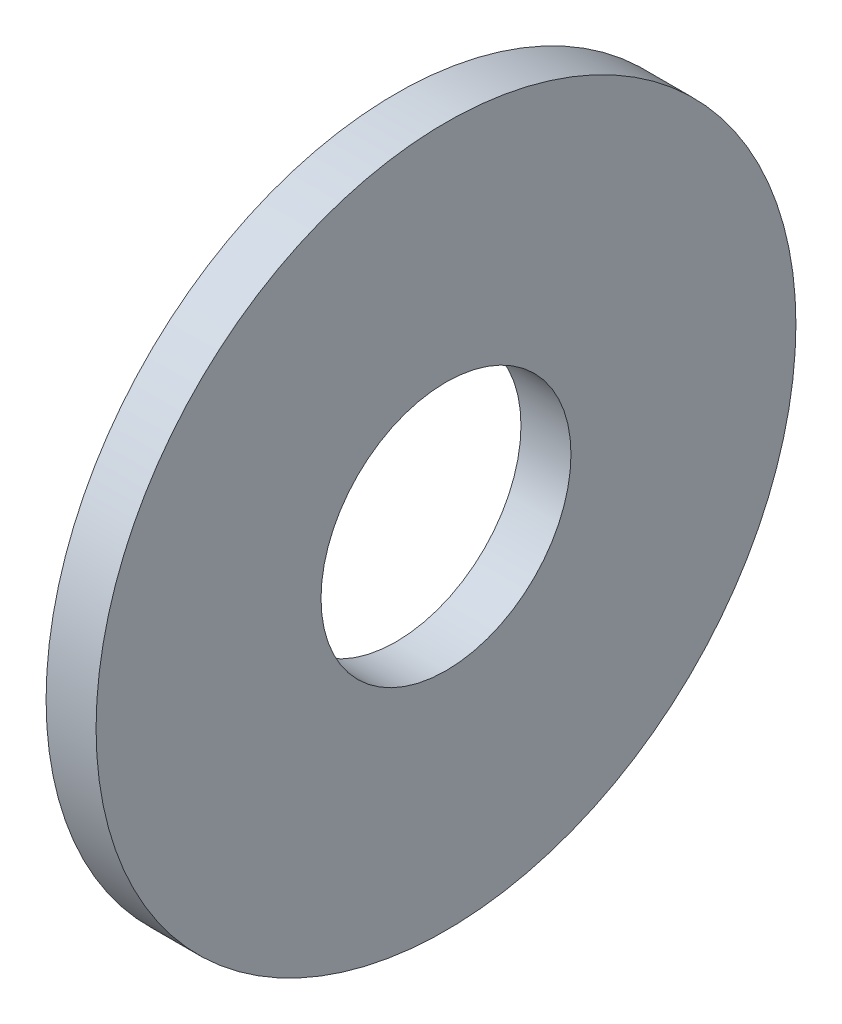
from build123d import *

# Parameters (mm, degrees)
SKETCH2_R           = 7
SKETCH2_R_2         = 2.5
BOSS_EXTRUDE1_DEPTH = 1


with BuildPart() as part:
    # Sketch2 → Boss-Extrude1 (new body)
    with BuildSketch(Plane(origin=(0, 0, 0), x_dir=(0, 0, -1), z_dir=(1, 0, 0))):
        Circle(SKETCH2_R)
        Circle(SKETCH2_R_2, mode=Mode.SUBTRACT)
    extrude(amount=BOSS_EXTRUDE1_DEPTH)


solid = part.part
